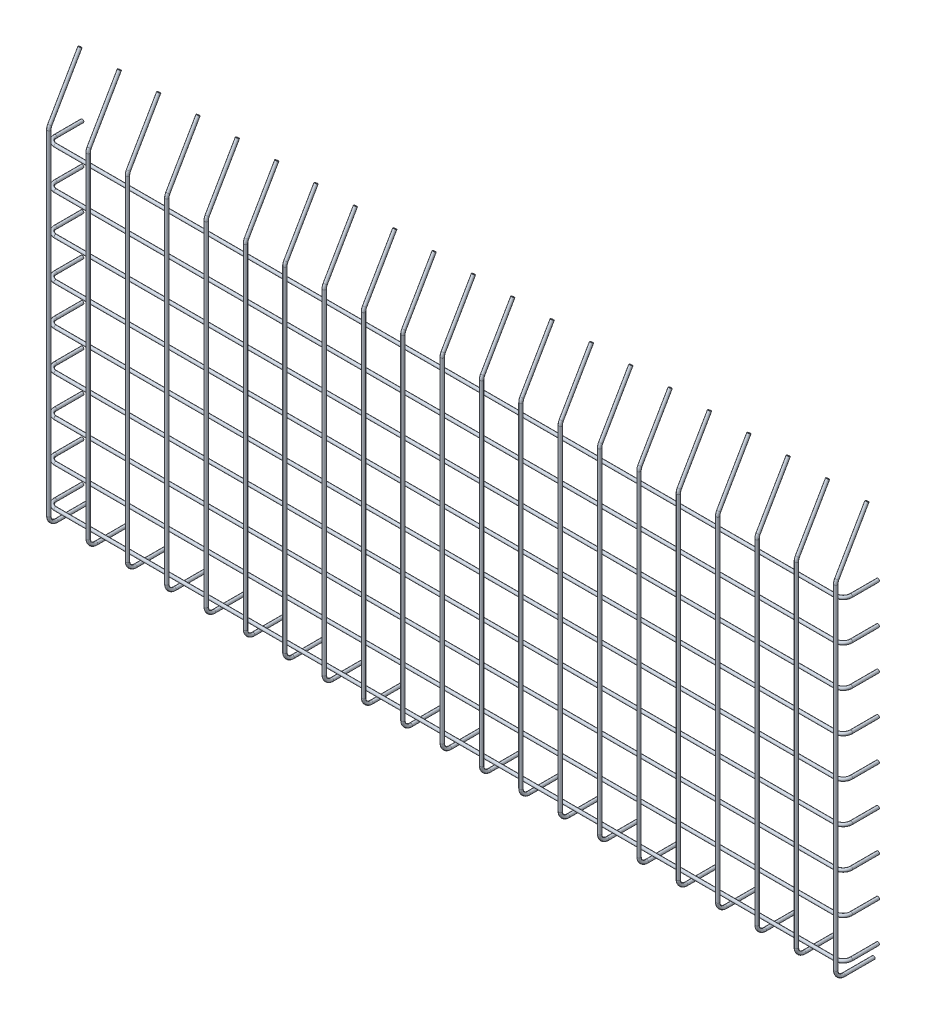
from build123d import *

# Parameters (mm, degrees)
SKETCH_2_R             = 2
PATTERN_LINEAR_1_COUNT = 11
PATTERN_LINEAR_1_PITCH = 50
SKETCH_4_R             = 2
PATTERN_LINEAR_3_COUNT = 9
PATTERN_LINEAR_3_PITCH = 50


with BuildPart() as part:
    # По траектории1: sweep along a path in Эскиз1
    with BuildLine(Plane(origin=(0, 0, 0), x_dir=(0, 0, -1), z_dir=(1, 0, 0))) as sweep_1_path:
        Line((50, 2), (12, 2))
        ThreePointArc((12, 2), (4.928932188, 4.928932188), (2, 12))
        Line((2, 12), (2, 436.806239917))
        ThreePointArc((2, 436.806239917), (2.340741737, 439.394430368), (3.339745962, 441.806239917))
        Line((3.339745962, 441.806239917), (41.669872981, 508.195967375))
    # Эскиз2 → По траектории1 (sweep)
    with BuildSketch(Plane(origin=(0, 0, -50), x_dir=(-1, 0, 0), z_dir=(0, 0, -1))):
        with Locations((0, 2)):
            Circle(SKETCH_2_R)
    sweep(path=sweep_1_path.line)


with BuildPart() as pattern_linear_1_1:
    # Линейный массив1: pattern copy
    add(part.part.moved(Location(Vector(1, 0, 0) * (1 * PATTERN_LINEAR_1_PITCH))))


with BuildPart() as pattern_linear_1_2:
    # Линейный массив1: pattern copy
    add(part.part.moved(Location(Vector(1, 0, 0) * (2 * PATTERN_LINEAR_1_PITCH))))


with BuildPart() as pattern_linear_1_3:
    # Линейный массив1: pattern copy
    add(part.part.moved(Location(Vector(1, 0, 0) * (3 * PATTERN_LINEAR_1_PITCH))))


with BuildPart() as pattern_linear_1_4:
    # Линейный массив1: pattern copy
    add(part.part.moved(Location(Vector(1, 0, 0) * (4 * PATTERN_LINEAR_1_PITCH))))


with BuildPart() as pattern_linear_1_5:
    # Линейный массив1: pattern copy
    add(part.part.moved(Location(Vector(1, 0, 0) * (5 * PATTERN_LINEAR_1_PITCH))))


with BuildPart() as pattern_linear_1_6:
    # Линейный массив1: pattern copy
    add(part.part.moved(Location(Vector(1, 0, 0) * (6 * PATTERN_LINEAR_1_PITCH))))


with BuildPart() as pattern_linear_1_7:
    # Линейный массив1: pattern copy
    add(part.part.moved(Location(Vector(1, 0, 0) * (7 * PATTERN_LINEAR_1_PITCH))))


with BuildPart() as pattern_linear_1_8:
    # Линейный массив1: pattern copy
    add(part.part.moved(Location(Vector(1, 0, 0) * (8 * PATTERN_LINEAR_1_PITCH))))


with BuildPart() as pattern_linear_1_9:
    # Линейный массив1: pattern copy
    add(part.part.moved(Location(Vector(1, 0, 0) * (9 * PATTERN_LINEAR_1_PITCH))))


with BuildPart() as pattern_linear_1_10:
    # Линейный массив1: pattern copy
    add(part.part.moved(Location(Vector(1, 0, 0) * (10 * PATTERN_LINEAR_1_PITCH))))


with BuildPart() as body_12:
    # Зеркальное отражение1: mirrored copy
    add(pattern_linear_1_1.part.mirror(Plane(origin=(0, 0, 0), x_dir=(0, 0, 1), z_dir=(1, 0, 0))))


with BuildPart() as body_13:
    # Mirror 1 2: mirrored copy
    add(pattern_linear_1_2.part.mirror(Plane(origin=(0, 0, 0), x_dir=(0, 0, 1), z_dir=(1, 0, 0))))


with BuildPart() as body_14:
    # Mirror 1 3: mirrored copy
    add(pattern_linear_1_3.part.mirror(Plane(origin=(0, 0, 0), x_dir=(0, 0, 1), z_dir=(1, 0, 0))))


with BuildPart() as body_15:
    # Mirror 1 4: mirrored copy
    add(pattern_linear_1_4.part.mirror(Plane(origin=(0, 0, 0), x_dir=(0, 0, 1), z_dir=(1, 0, 0))))


with BuildPart() as body_16:
    # Mirror 1 5: mirrored copy
    add(pattern_linear_1_5.part.mirror(Plane(origin=(0, 0, 0), x_dir=(0, 0, 1), z_dir=(1, 0, 0))))


with BuildPart() as body_17:
    # Mirror 1 6: mirrored copy
    add(pattern_linear_1_6.part.mirror(Plane(origin=(0, 0, 0), x_dir=(0, 0, 1), z_dir=(1, 0, 0))))


with BuildPart() as body_18:
    # Mirror 1 7: mirrored copy
    add(pattern_linear_1_7.part.mirror(Plane(origin=(0, 0, 0), x_dir=(0, 0, 1), z_dir=(1, 0, 0))))


with BuildPart() as body_19:
    # Mirror 1 8: mirrored copy
    add(pattern_linear_1_8.part.mirror(Plane(origin=(0, 0, 0), x_dir=(0, 0, 1), z_dir=(1, 0, 0))))


with BuildPart() as body_20:
    # Mirror 1 9: mirrored copy
    add(pattern_linear_1_9.part.mirror(Plane(origin=(0, 0, 0), x_dir=(0, 0, 1), z_dir=(1, 0, 0))))


with BuildPart() as body_21:
    # Mirror 1 10: mirrored copy
    add(pattern_linear_1_10.part.mirror(Plane(origin=(0, 0, 0), x_dir=(0, 0, 1), z_dir=(1, 0, 0))))


with BuildPart() as body_22:
    # По траектории2: sweep along a path in Эскиз3
    with BuildLine(Plane(origin=(0, 20, 0), x_dir=(1, 0, 0), z_dir=(0, 1, 0))) as sweep_2_path:
        Line((-505.5, 50), (-505.5, 16))
        ThreePointArc((-505.5, 16), (-502.571067812, 8.928932188), (-495.5, 6))
        Line((-495.5, 6), (495.5, 6))
        ThreePointArc((495.5, 6), (502.571067812, 8.928932188), (505.5, 16))
        Line((505.5, 16), (505.5, 50))
    # Эскиз4 → По траектории2 (sweep)
    with BuildSketch(Plane(origin=(0, 0, -50), x_dir=(-1, 0, 0), z_dir=(0, 0, -1))):
        with Locations((505.5, 20)):
            Circle(SKETCH_4_R)
    sweep(path=sweep_2_path.line)


with BuildPart() as pattern_linear_3_1:
    # Линейный массив3: pattern copy
    add(body_22.part.moved(Location(Vector(0, 1, 0) * (1 * PATTERN_LINEAR_3_PITCH))))


with BuildPart() as pattern_linear_3_2:
    # Линейный массив3: pattern copy
    add(body_22.part.moved(Location(Vector(0, 1, 0) * (2 * PATTERN_LINEAR_3_PITCH))))


with BuildPart() as pattern_linear_3_3:
    # Линейный массив3: pattern copy
    add(body_22.part.moved(Location(Vector(0, 1, 0) * (3 * PATTERN_LINEAR_3_PITCH))))


with BuildPart() as pattern_linear_3_4:
    # Линейный массив3: pattern copy
    add(body_22.part.moved(Location(Vector(0, 1, 0) * (4 * PATTERN_LINEAR_3_PITCH))))


with BuildPart() as pattern_linear_3_5:
    # Линейный массив3: pattern copy
    add(body_22.part.moved(Location(Vector(0, 1, 0) * (5 * PATTERN_LINEAR_3_PITCH))))


with BuildPart() as pattern_linear_3_6:
    # Линейный массив3: pattern copy
    add(body_22.part.moved(Location(Vector(0, 1, 0) * (6 * PATTERN_LINEAR_3_PITCH))))


with BuildPart() as pattern_linear_3_7:
    # Линейный массив3: pattern copy
    add(body_22.part.moved(Location(Vector(0, 1, 0) * (7 * PATTERN_LINEAR_3_PITCH))))


with BuildPart() as pattern_linear_3_8:
    # Линейный массив3: pattern copy
    add(body_22.part.moved(Location(Vector(0, 1, 0) * (8 * PATTERN_LINEAR_3_PITCH))))


solid = Compound([part.part, pattern_linear_1_1.part, pattern_linear_1_2.part, pattern_linear_1_3.part, pattern_linear_1_4.part, pattern_linear_1_5.part, pattern_linear_1_6.part, pattern_linear_1_7.part, pattern_linear_1_8.part, pattern_linear_1_9.part, pattern_linear_1_10.part, body_12.part, body_13.part, body_14.part, body_15.part, body_16.part, body_17.part, body_18.part, body_19.part, body_20.part, body_21.part, body_22.part, pattern_linear_3_1.part, pattern_linear_3_2.part, pattern_linear_3_3.part, pattern_linear_3_4.part, pattern_linear_3_5.part, pattern_linear_3_6.part, pattern_linear_3_7.part, pattern_linear_3_8.part])
